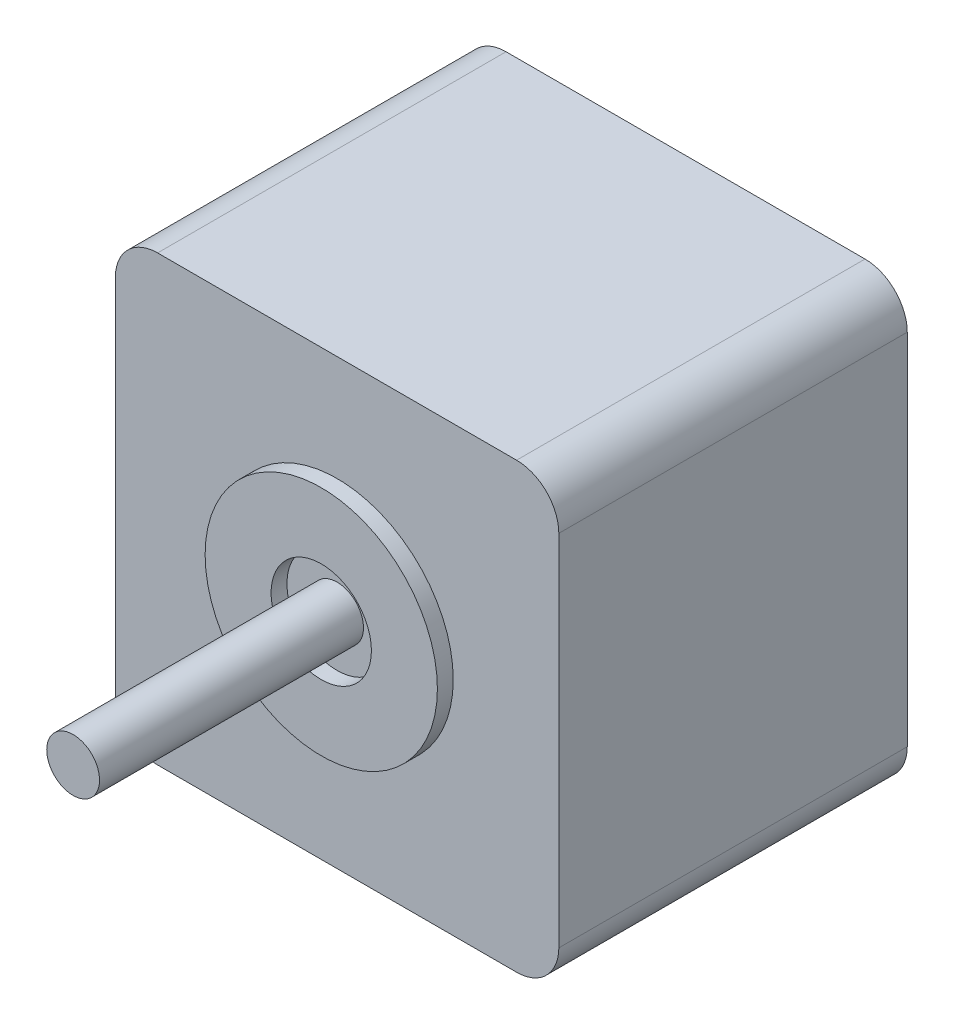
from build123d import *

# Parameters (mm, degrees)
CROQUIS1_W              = 42
CROQUIS1_H              = 42
SALIENTE_EXTRUIR1_DEPTH = 33
REDONDEO1_R             = 4
CROQUIS2_R              = 11
CROQUIS2_R_2            = 4.75
SALIENTE_EXTRUIR2_DEPTH = 1.5
CROQUIS2_4_R            = 2.5
SALIENTE_EXTRUIR3_DEPTH = 25


with BuildPart() as part:
    # Croquis1 → Saliente-Extruir1 (new body)
    with BuildSketch(Plane.XY):
        Rectangle(CROQUIS1_W, CROQUIS1_H)
    extrude(amount=SALIENTE_EXTRUIR1_DEPTH)

    # Redondeo1
    redondeo1_edges = [part.edges().sort_by_distance(p)[0] for p in [
        (-21, -21, 16.5),
        (21, -21, 16.5),
        (21, 21, 16.5),
        (-21, 21, 16.5),
    ]]
    fillet(redondeo1_edges, radius=REDONDEO1_R)

    # Croquis2 → Saliente-Extruir2 (add)
    with BuildSketch(Plane.XY.offset(33)):
        Circle(CROQUIS2_R)
        Circle(CROQUIS2_R_2, mode=Mode.SUBTRACT)
    extrude(amount=SALIENTE_EXTRUIR2_DEPTH)

    # Croquis2<4> → Saliente-Extruir3 (add)
    with BuildSketch(Plane.XY.offset(33)):
        Circle(CROQUIS2_4_R)
    extrude(amount=SALIENTE_EXTRUIR3_DEPTH)


solid = part.part
